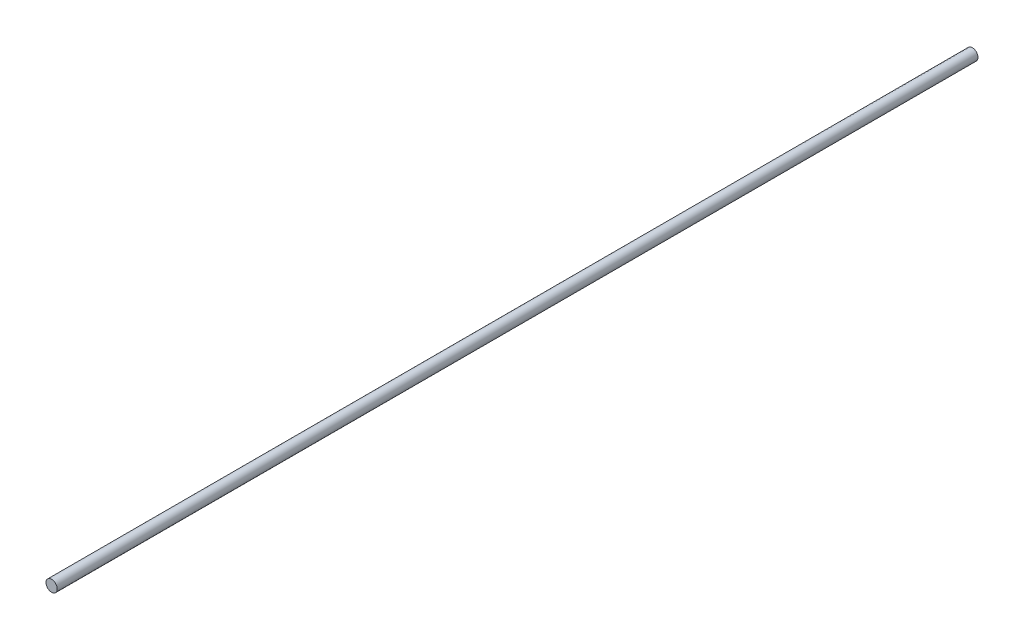
from build123d import *

# Parameters (mm, degrees)
SKETCH_1_R      = 4
EXTRUDE_1_DEPTH = 640
SKETCH_2_R      = 4
EXTRUDE_2_DEPTH = 13.91


with BuildPart() as part:
    # 스케치1 → 보스-돌출1 (new body)
    with BuildSketch(Plane.XY):
        Circle(SKETCH_1_R)
    extrude(amount=EXTRUDE_1_DEPTH)

    # 스케치2 → 보스-돌출2 (add)
    with BuildSketch(Plane.XY.offset(640)):
        Circle(SKETCH_2_R)
    extrude(amount=EXTRUDE_2_DEPTH)


solid = part.part
